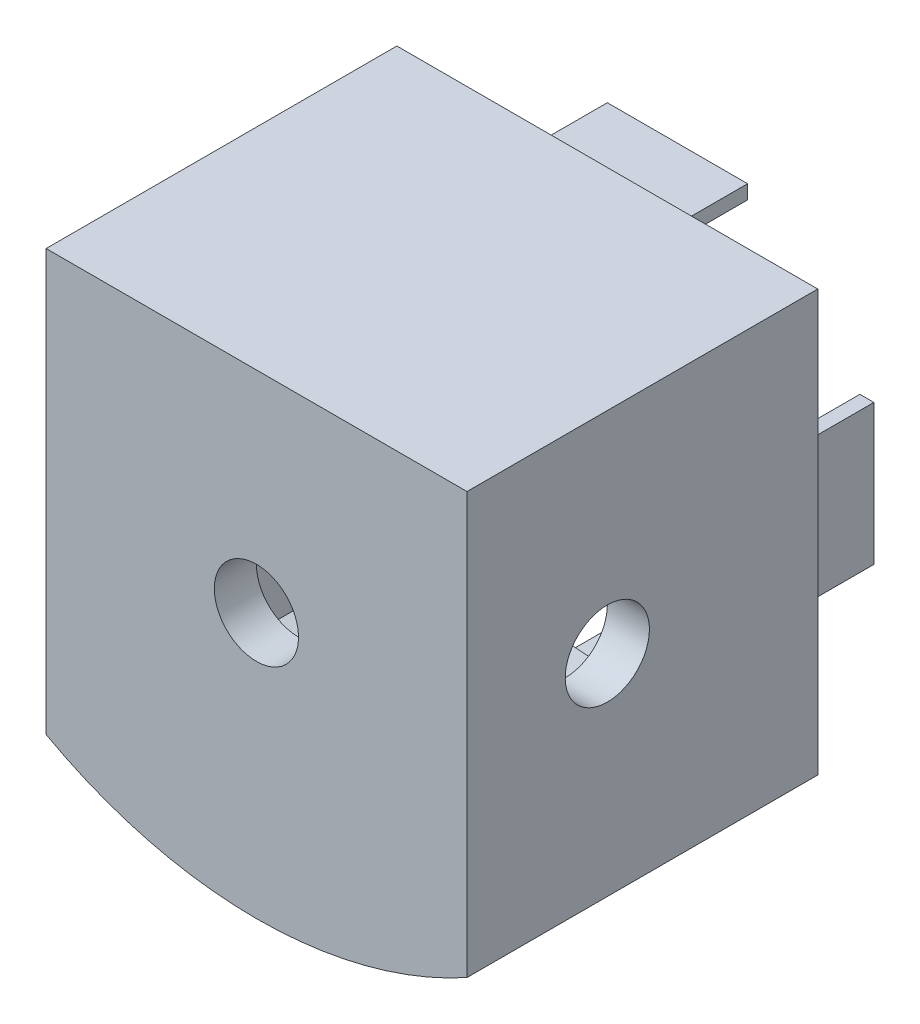
from build123d import *

# Parameters (mm, degrees)
BOSS_EXTRUDE1_DEPTH = 25
SHELL13_T           = -3
SKETCH3_R           = 3
CUT_EXTRUDE2_DEPTH  = 3
SKETCH4_W           = 10
SKETCH4_H           = 1
SKETCH4_W_2         = 1
SKETCH4_H_2         = 10
SKETCH4_W_3         = 7
BOSS_EXTRUDE2_DEPTH = 5
SKETCH5_R           = 3
CUT_EXTRUDE3_DEPTH  = 30


with BuildPart() as part:
    # Sketch1 → Boss-Extrude1 (new body)
    with BuildSketch(Plane.XY):
        with BuildLine():
            Line((15, -15), (15, 15))
            Line((15, 15), (-15, 15))
            Line((-15, 15), (-15, -15))
            ThreePointArc((-15, -15), (0, -18.870680067), (15, -15))
        make_face()
    extrude(amount=BOSS_EXTRUDE1_DEPTH)

    # Shell13
    shell13_openings = [part.faces().sort_by_distance(p)[0] for p in [
        (0, -1.327259688, 0),
    ]]
    offset(amount=SHELL13_T, openings=shell13_openings, kind=Kind.INTERSECTION)

    # Sketch3 → Cut-Extrude2 (cut)
    with BuildSketch(Plane(origin=(0, 0, 22), x_dir=(-1, 0, 0), z_dir=(0, 0, -1))):
        with Locations((0.010259738, 0.007572697)):
            Circle(SKETCH3_R)
    extrude(amount=-CUT_EXTRUDE2_DEPTH, mode=Mode.SUBTRACT)

    # Sketch4 → Boss-Extrude2 (add)
    with BuildSketch(Plane(origin=(0, 0, 0), x_dir=(-1, 0, 0), z_dir=(0, 0, -1))):
        with Locations((0, 13.5)):
            Rectangle(SKETCH4_W, SKETCH4_H)
        with Locations((-13.5, 0)):
            Rectangle(SKETCH4_W_2, SKETCH4_H_2)
        with Locations((0, -17.5)):
            Rectangle(SKETCH4_W_3, SKETCH4_H)
        with Locations((13.5, 0)):
            Rectangle(SKETCH4_W_2, SKETCH4_H_2)
    extrude(amount=BOSS_EXTRUDE2_DEPTH)

    # Sketch5 → Cut-Extrude3 (cut)
    with BuildSketch(Plane(origin=(15, 0, 0), x_dir=(0, 0, -1), z_dir=(1, 0, 0))):
        with Locations(Location((-15, 0, 0), (0, 0, 90))):
            Circle(SKETCH5_R)
    extrude(amount=-CUT_EXTRUDE3_DEPTH, mode=Mode.SUBTRACT)


solid = part.part
